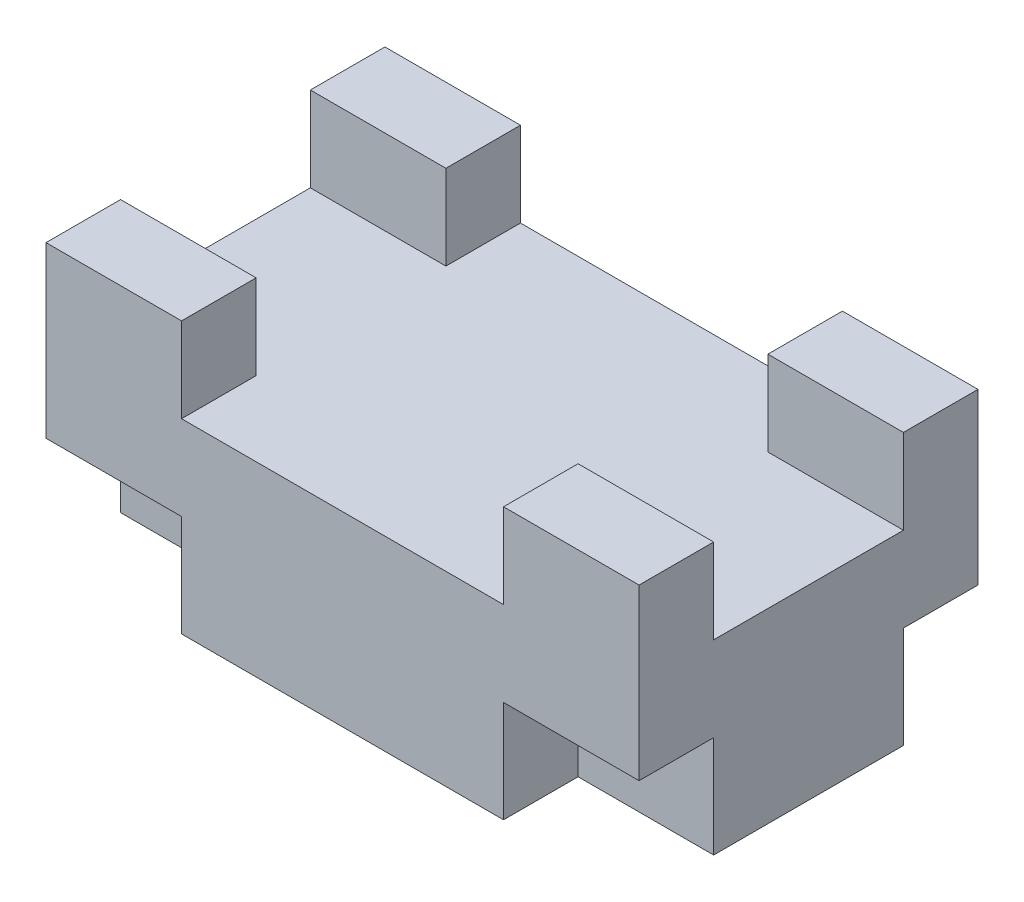
from build123d import *

# Parameters (mm, degrees)
SKETCH1_W                                  = 175
SKETCH1_H                                  = 80
BOSS_EXTRUDE1_DEPTH                        = 50
CUT_EXTRUDE1_DEPTH                         = 25
SKETCH3_W                                  = 40
SKETCH3_H                                  = 22
CUT_EXTRUDE2_DEPTH                         = 30
MIRROR1_AT_THE_SECOND_PLANE_COPY_1_SKETC_W = 40
MIRROR1_AT_THE_SECOND_PLANE_COPY_1_SKETC_H = 22
MIRROR1_AT_THE_SECOND_PLANE_COPY_1_DEPTH   = 30


with BuildPart() as part:
    # Sketch1 → Boss-Extrude1 (new, symmetric)
    with BuildSketch(Plane.XY):
        Rectangle(SKETCH1_W, SKETCH1_H)
    extrude(amount=BOSS_EXTRUDE1_DEPTH, both=True)

    # Sketch2 → Cut-Extrude1 (cut)
    with BuildSketch(Plane(origin=(0, 40, 0), x_dir=(1, 0, 0), z_dir=(0, 1, 0))):
        Polygon((47.5, -50), (-47.5, -50), (-47.5, -28), (-87.5, -28), (-87.5, 28), (-47.5, 28), (-47.5, 50), (47.5, 50), (47.5, 28), (87.5, 28), (87.5, -28), (47.5, -28), align=None)
    extrude(amount=-CUT_EXTRUDE1_DEPTH, mode=Mode.SUBTRACT)

    # Sketch3 → Cut-Extrude2 (cut)
    with BuildSketch(Plane.XZ.offset(40)):
        with Locations((67.5, 39)):
            Rectangle(SKETCH3_W, SKETCH3_H)
    cut_extrude2 = extrude(amount=-CUT_EXTRUDE2_DEPTH, mode=Mode.SUBTRACT)

    # Mirror1: Cut-Extrude2 across plane
    add(cut_extrude2.mirror(Plane(origin=(0, 0, 0), x_dir=(0, 0, 1), z_dir=(1, 0, 0))), mode=Mode.SUBTRACT)

    # Mirror1 at the second plane: Cut-Extrude2 across plane
    add(cut_extrude2.mirror(Plane.XY), mode=Mode.SUBTRACT)

    # Mirror1 at the second plane copy 1 sketc → Mirror1 at the second plane copy 1 (cut)
    with BuildSketch(Plane(origin=(0, -40, 0), x_dir=(-1, 0, 0), z_dir=(0, -1, 0))):
        with Locations((67.5, 39)):
            Rectangle(MIRROR1_AT_THE_SECOND_PLANE_COPY_1_SKETC_W, MIRROR1_AT_THE_SECOND_PLANE_COPY_1_SKETC_H)
    extrude(amount=-MIRROR1_AT_THE_SECOND_PLANE_COPY_1_DEPTH, mode=Mode.SUBTRACT)


solid = part.part
